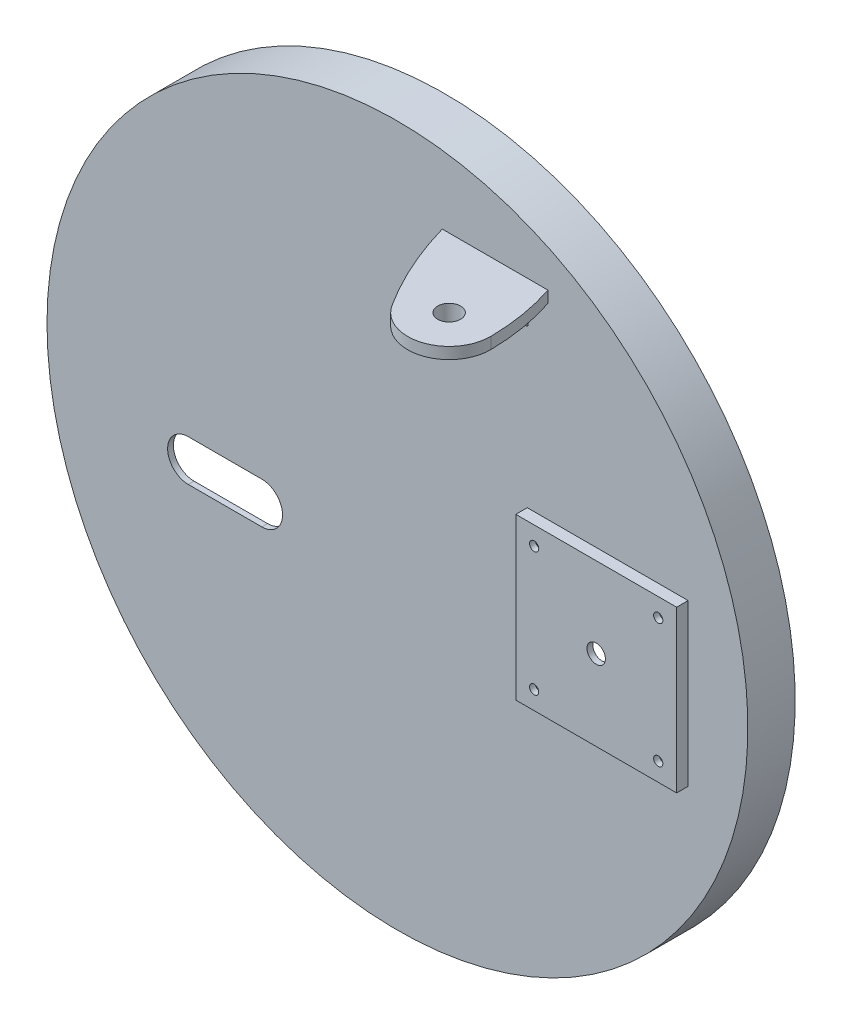
from build123d import *

# Parameters (mm, degrees)
SKETCH_1_R          = 305
EXTRUDE_1_DEPTH     = 41.2
SKETCH_2_W          = 140
SKETCH_2_H          = 140
EXTRUDE_2_DEPTH     = 10
SHELL_1_T           = -5
CUT_EXTRUDE_1_DEPTH = 10
SKETCH_4_W          = 120
SKETCH_4_H          = 10
EXTRUDE_3_DEPTH     = 150
CUT_EXTRUDE_2_DEPTH = 648.322516216
SKETCH_7_R          = 10
CUT_EXTRUDE_3_DEPTH = 150
EXTRUDE_START       = 10
SKETCH_8_R          = 20
SKETCH_8_R_2        = 10
EXTRUDE_4_DEPTH     = 10
SKETCH_9_W          = 5
SKETCH_9_H          = 36
EXTRUDE_5_DEPTH     = 26
CUT_EXTRUDE_4_DEPTH = 505.336286618
SKETCH_11_W         = 18
SKETCH_11_H         = 5
SKETCH_11_W_2       = 5
SKETCH_11_H_2       = 46.5
SKETCH_12_R         = 4
SKETCH_12_R_2       = 8
CUT_EXTRUDE_5_DEPTH = 26


with BuildPart() as part:
    # 草图1 → 凸台-拉伸1 (new body)
    with BuildSketch(Plane.XY):
        with Locations(Location((0, 0, 0), (0, 0, 180))):
            Circle(SKETCH_1_R)
    extrude(amount=EXTRUDE_1_DEPTH)

    # 草图2 → 凸台-拉伸2 (add)
    with BuildSketch(Plane.XY.offset(41.2)):
        with Locations((183, 0)):
            Rectangle(SKETCH_2_W, SKETCH_2_H)
    extrude(amount=EXTRUDE_2_DEPTH)

    # 抽壳1
    shell_1_openings = [part.faces().sort_by_distance(p)[0] for p in [
        (0, 0, 0),
    ]]
    offset(amount=SHELL_1_T, openings=shell_1_openings, kind=Kind.INTERSECTION)

    # 草图3 → 切除-拉伸1 (cut)
    with BuildSketch(Plane.XY.offset(41.2)):
        with BuildLine():
            Line((-182, -24), (-118, -24))
            ThreePointArc((-118, -24), (-100, -42), (-118, -60))
            Line((-118, -60), (-182, -60))
            ThreePointArc((-182, -60), (-200, -42), (-182, -24))
        make_face()
    extrude(amount=-CUT_EXTRUDE_1_DEPTH, mode=Mode.SUBTRACT)

    # 草图4 → 凸台-拉伸3 (add)
    with BuildSketch(Plane.XY.offset(41.2)):
        with Locations((99, 238)):
            Rectangle(SKETCH_4_W, SKETCH_4_H)
    extrude(amount=EXTRUDE_3_DEPTH)

    # 草图6 → 切除-拉伸2 (cut, through all)
    with BuildSketch(Plane.XZ.offset(-233)):
        with BuildLine():
            Line((39, 191.2), (39, 41.2))
            ThreePointArc((39, 41.2), (53.931588882, 82.177347592), (74.646786984, 120.556716136))
            ThreePointArc((74.646786984, 120.556716136), (115.26317996, 135.706044936), (140.99801314, 100.821780537))
            ThreePointArc((140.99801314, 100.821780537), (138.32356193, 70.621084147), (131, 41.2))
            Line((131, 41.2), (159, 41.2))
            Line((159, 41.2), (159, 191.2))
            Line((159, 191.2), (39, 191.2))
        make_face()
    extrude(amount=-CUT_EXTRUDE_2_DEPTH, mode=Mode.SUBTRACT)

    # 草图7 → 切除-拉伸3 (cut)
    with BuildSketch(Plane.XZ.offset(-233)):
        with Locations(Location((105, 101.2, 0), (0, 0, 270))):
            Circle(SKETCH_7_R)
    extrude(amount=-CUT_EXTRUDE_3_DEPTH, mode=Mode.SUBTRACT)

    # 草图8 → 凸台-拉伸4 (add)
    with BuildSketch(Plane.XZ.offset(-233).offset(EXTRUDE_START)):
        with Locations(Location((105, 101.2, 0), (0, 0, 90))):
            Circle(SKETCH_8_R)
        with Locations(Location((105, 101.2, 0), (0, 0, 270))):
            Circle(SKETCH_8_R_2, mode=Mode.SUBTRACT)
    extrude(amount=-EXTRUDE_4_DEPTH)

    # 草图9 → 凸台-拉伸5 (add)
    with BuildSketch(Plane.XZ.offset(-233)):
        with Locations((75, 59.2)):
            Rectangle(SKETCH_9_W, SKETCH_9_H)
        with Locations((111, 59.2)):
            Rectangle(SKETCH_9_W, SKETCH_9_H)
    extrude(amount=EXTRUDE_5_DEPTH)

    # 草图10 → 切除-拉伸4 (cut, through all)
    with BuildSketch(Plane.ZY.offset(-72.5)):
        Polygon((77.2, 233), (41.2, 207), (77.2, 207), align=None)
    extrude(amount=-CUT_EXTRUDE_4_DEPTH, mode=Mode.SUBTRACT)

    # 草图11 → 旋转1 (revolve)
    with BuildSketch(Plane(origin=(0, 0, 0), x_dir=(1, 0, 0), z_dir=(0, 1, 0)), mode=Mode.PRIVATE) as revolve_1_sk:
        with Locations((-66, -33.7)):
            Rectangle(SKETCH_11_W, SKETCH_11_H)
        with Locations((-82.5, -12.95)):
            Rectangle(SKETCH_11_W_2, SKETCH_11_H_2)
    revolve(revolve_1_sk.sketch.rotate(Axis((0, 0, 0), (0, 0, -1)), 180), axis=Axis((0, 0, 0), (0, 0, -1)))

    # 草图12 → 切除-拉伸5 (cut)
    with BuildSketch(Plane.XY.offset(51.2)):
        with Locations((237, 54)):
            Circle(SKETCH_12_R)
        with Locations((237, -54)):
            Circle(SKETCH_12_R)
        with Locations((129, -54)):
            Circle(SKETCH_12_R)
        with Locations((129, 54)):
            Circle(SKETCH_12_R)
        with Locations((183, 0)):
            Circle(SKETCH_12_R_2)
    extrude(amount=-CUT_EXTRUDE_5_DEPTH, mode=Mode.SUBTRACT)


solid = part.part
